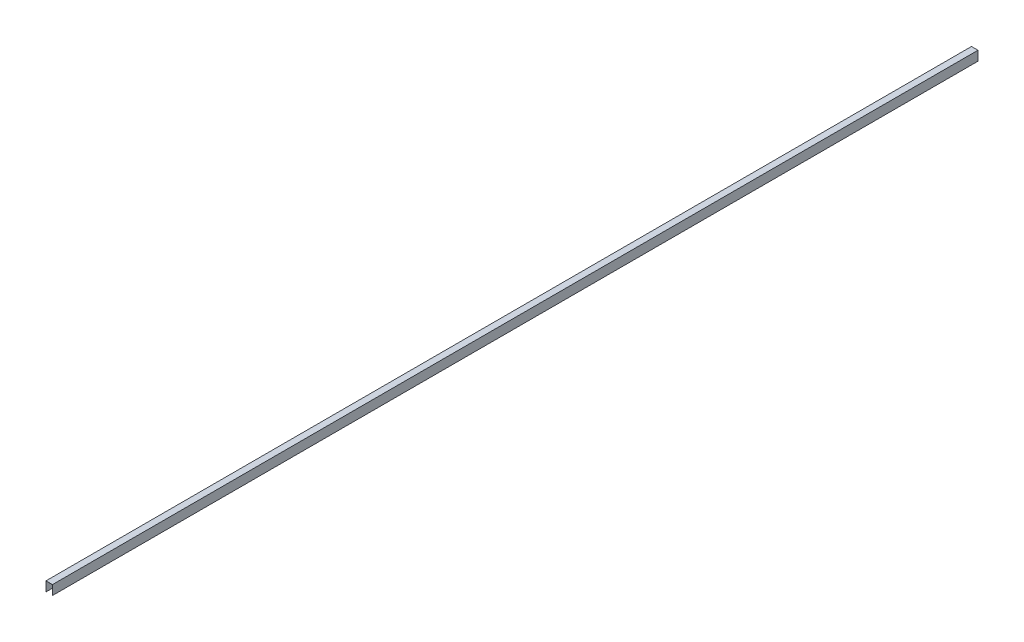
from build123d import *

# Parameters (mm, degrees)
BOSS_EXTRUDE1_DEPTH = 1879.6


with BuildPart() as part:
    # Sketch1 → Boss-Extrude1 (new body)
    with BuildSketch(Plane.XY):
        Polygon((0, 0), (0, 19.304), (13.208, 19.304), (13.208, 0), (12.954, 0), (12.954, 19.05), (0.254, 19.05), (0.254, 0), align=None)
    extrude(amount=BOSS_EXTRUDE1_DEPTH)


solid = part.part
